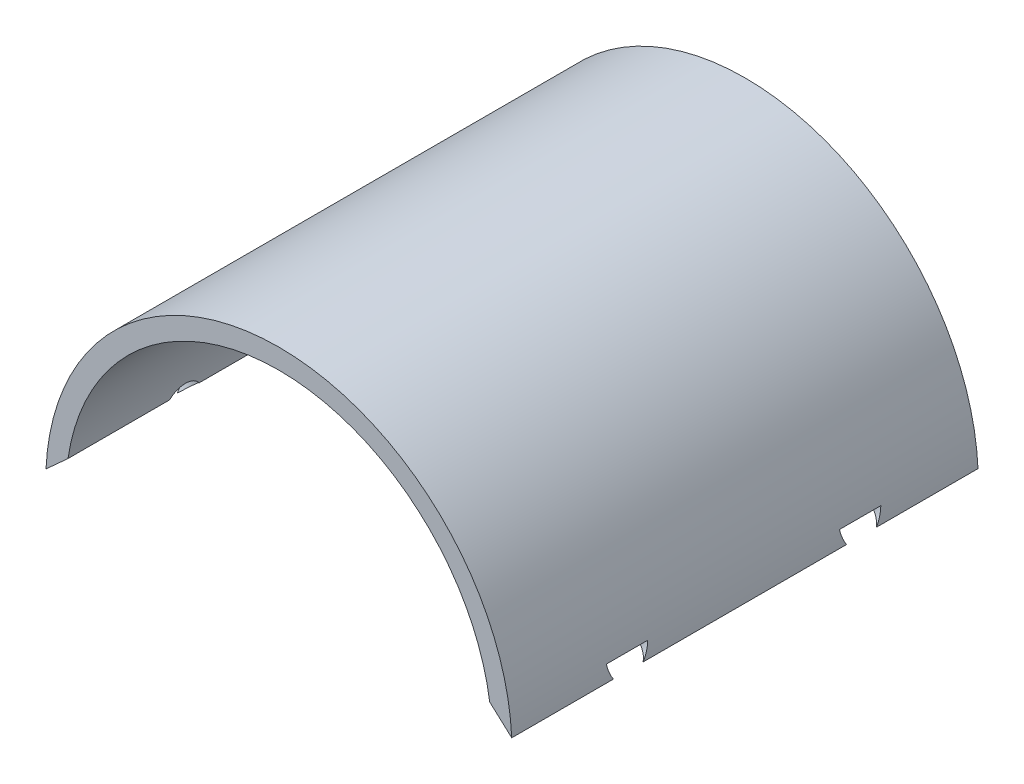
from build123d import *

# Parameters (mm, degrees)
BOSS_EXTRUDE1_DEPTH = 88.9
SKETCH2_R           = 4
CUT_EXTRUDE1_DEPTH  = 2
SKETCH3_R           = 4
CUT_EXTRUDE2_DEPTH  = 2


with BuildPart() as part:
    # Sketch1 → Boss-Extrude1 (new body)
    with BuildSketch(Plane.XY):
        with BuildLine():
            Line((-40.203883769, 5.937788296), (-44.399042974, 2.127788296))
            ThreePointArc((-44.399042974, 2.127788296), (0, 44.45), (44.399042974, 2.127788296))
            Line((44.399042974, 2.127788296), (40.203883769, 5.937788296))
            ThreePointArc((40.203883769, 5.937788296), (0, 40.64), (-40.203883769, 5.937788296))
        make_face()
    extrude(amount=BOSS_EXTRUDE1_DEPTH)

    # Sketch2 → Cut-Extrude1 (cut)
    with BuildSketch(Plane(origin=(-21.127225221, 23.263011377, 0), x_dir=(0.7402720771062566, 0.6723074087475077, 0), z_dir=(0.6723074087475077, -0.7402720771062566, 0))):
        with Locations((-28.603318705, 66.727309036)):
            Circle(SKETCH2_R)
        with Locations((-28.603318705, 22.172690964)):
            Circle(SKETCH2_R)
    extrude(amount=-CUT_EXTRUDE1_DEPTH, mode=Mode.SUBTRACT)

    # Sketch3 → Cut-Extrude2 (cut)
    with BuildSketch(Plane(origin=(21.127225221, 23.263011377, 0), x_dir=(0.7402720771062566, -0.6723074087475077, 0), z_dir=(-0.6723074087475077, -0.7402720771062566, 0))):
        with Locations((28.603318705, 66.675)):
            Circle(SKETCH3_R)
        with Locations((28.603318705, 22.225)):
            Circle(SKETCH3_R)
    extrude(amount=-CUT_EXTRUDE2_DEPTH, mode=Mode.SUBTRACT)


solid = part.part
